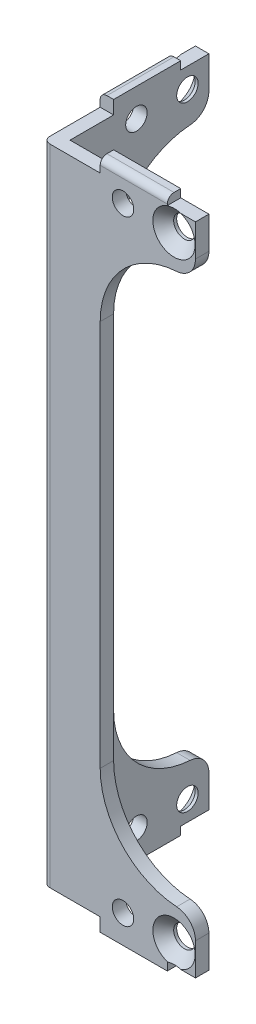
from build123d import *

# Parameters (mm, degrees)
BOSS_EXTRUDE3_DEPTH                                 = 48
SKETCH9_R                                           = 1.6
BOSS_EXTRUDE5_DEPTH                                 = 2
SKETCH6_R                                           = 1.6
BOSS_EXTRUDE6_DEPTH                                 = 2
FILLET4_R                                           = 1
FILLET5_R                                           = 12.2
CSK_FOR_M3_COUNTERSUNK_FLAT_HEAD_SCREW1_D           = 3.2
CSK_FOR_M3_COUNTERSUNK_FLAT_HEAD_SCREW1_CSINK_D     = 6.3
CSK_FOR_M3_COUNTERSUNK_FLAT_HEAD_SCREW1_CSINK_ANGLE = 90
CSK_FOR_M3_COUNTERSUNK_FLAT_HEAD_SCREW2_D           = 3.2
CSK_FOR_M3_COUNTERSUNK_FLAT_HEAD_SCREW2_CSINK_D     = 6.3
CSK_FOR_M3_COUNTERSUNK_FLAT_HEAD_SCREW2_CSINK_ANGLE = 90


with BuildPart() as part:
    # Sketch5 → Boss-Extrude3 (new, symmetric)
    with BuildSketch(Plane(origin=(0, 0, 0), x_dir=(1, 0, 0), z_dir=(0, 1, 0))):
        Polygon((0, 8.5), (0, 0), (8.5, 0), (8.5, 2), (2, 2), (2, 8.5), align=None)
    extrude(amount=BOSS_EXTRUDE3_DEPTH, both=True)

    # Sketch9 → Boss-Extrude5 (add)
    with BuildSketch(Plane.XY):
        with BuildLine():
            Line((8.5, 50), (18.5, 50))
            Line((18.5, 50), (18.5, 48.8))
            Line((18.5, 48.8), (22.7, 48.8))
            Line((22.7, 48.8), (22.7, 44))
            ThreePointArc((22.7, 44), (21.821320344, 41.878679656), (19.7, 41))
            Line((19.7, 41), (8.5, 41))
            Line((8.5, 41), (8.5, 50))
        make_face()
        with Locations((11.9, 45.8)):
            Circle(SKETCH9_R, mode=Mode.SUBTRACT)
        with Locations((19.5, 45.8)):
            Circle(SKETCH9_R, mode=Mode.SUBTRACT)
    boss_extrude5 = extrude(amount=-BOSS_EXTRUDE5_DEPTH)

    # Sketch6 → Boss-Extrude6 (add)
    with BuildSketch(Plane.ZY):
        with BuildLine():
            Line((-8.5, 41), (-19.7, 41))
            ThreePointArc((-19.7, 41), (-21.821320344, 41.878679656), (-22.7, 44))
            Line((-22.7, 44), (-22.7, 48.8))
            Line((-22.7, 48.8), (-18.5, 48.8))
            Line((-18.5, 48.8), (-18.5, 50))
            Line((-18.5, 50), (-8.5, 50))
            Line((-8.5, 50), (-8.5, 41))
        make_face()
        with Locations((-11.9, 45.8)):
            Circle(SKETCH6_R, mode=Mode.SUBTRACT)
        with Locations((-19.5, 45.8)):
            Circle(SKETCH6_R, mode=Mode.SUBTRACT)
    boss_extrude6 = extrude(amount=-BOSS_EXTRUDE6_DEPTH)

    # Mirror1: Boss-Extrude5, Boss-Extrude6 across plane
    add(boss_extrude5.mirror(Plane.ZX))
    add(boss_extrude6.mirror(Plane.ZX))

    # Fillet4
    fillet4_edges = [part.edges().sort_by_distance(p)[0] for p in [
        (0, 0, 0),
        (13.5, 50, 0),
        (0, 50, -13.5),
    ]]
    fillet(fillet4_edges, radius=FILLET4_R)

    # Fillet5
    fillet5_edges = [part.edges().sort_by_distance(p)[0] for p in [
        (8.5, -41, -1),
        (8.5, 41, -1),
        (1, 41, -8.5),
        (1, -41, -8.5),
    ]]
    fillet(fillet5_edges, radius=FILLET5_R)

    # CSK for M3 Countersunk Flat Head Screw1 (through all)
    with Locations(Plane.ZY):
        with Locations((-19.5, 45.8)):
            csk_for_m3_countersunk_flat_head_screw1 = CounterSinkHole(CSK_FOR_M3_COUNTERSUNK_FLAT_HEAD_SCREW1_D / 2, CSK_FOR_M3_COUNTERSUNK_FLAT_HEAD_SCREW1_CSINK_D / 2, counter_sink_angle=CSK_FOR_M3_COUNTERSUNK_FLAT_HEAD_SCREW1_CSINK_ANGLE)

    # CSK for M3 Countersunk Flat Head Screw2 (through all)
    with Locations(Plane.XY):
        with Locations((19.5, 45.8)):
            csk_for_m3_countersunk_flat_head_screw2 = CounterSinkHole(CSK_FOR_M3_COUNTERSUNK_FLAT_HEAD_SCREW2_D / 2, CSK_FOR_M3_COUNTERSUNK_FLAT_HEAD_SCREW2_CSINK_D / 2, counter_sink_angle=CSK_FOR_M3_COUNTERSUNK_FLAT_HEAD_SCREW2_CSINK_ANGLE)

    # Mirror2: CSK for M3 Countersunk Flat Head Screw1, CSK for M3 Countersunk Flat Head Screw2 across plane
    add(csk_for_m3_countersunk_flat_head_screw1.mirror(Plane.ZX), mode=Mode.SUBTRACT)
    add(csk_for_m3_countersunk_flat_head_screw2.mirror(Plane.ZX), mode=Mode.SUBTRACT)


solid = part.part
